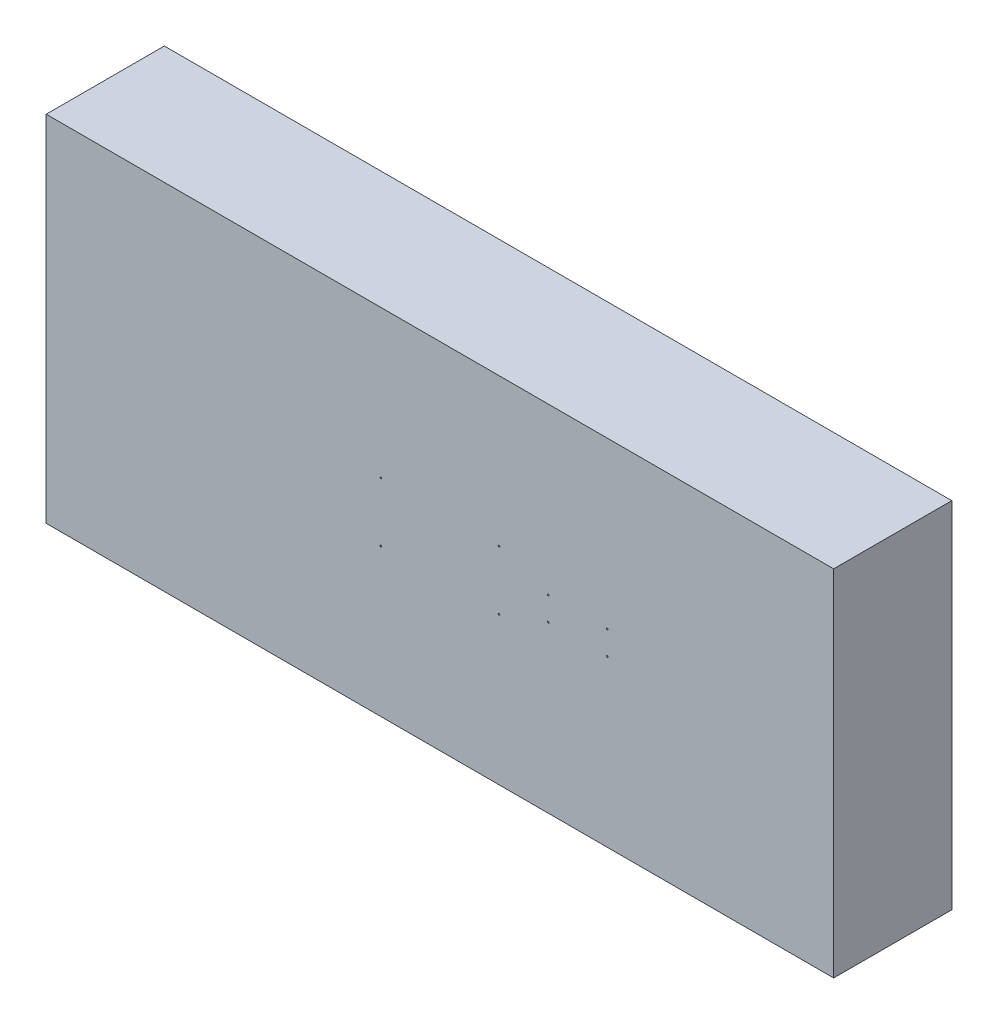
from build123d import *

# Parameters (mm, degrees)
BOSS_EXTRUDE2_DEPTH             = 500
BOSS_EXTRUDE2_DEPTH_BACK        = 500
SKETCH1_W                       = 450
SKETCH1_H                       = 150
F_2_0MM_DOWEL_HOLE1_D           = 2
F_2_0MM_DOWEL_HOLE1_DEPTH       = 10
F_2_0MM_DOWEL_HOLE1_CSINK_D     = 2.05
F_2_0MM_DOWEL_HOLE1_CSINK_ANGLE = 90
F_2_0MM_DOWEL_HOLE1_TIP         = 0.600860619
F_2_0MM_DOWEL_HOLE2_D           = 2
F_2_0MM_DOWEL_HOLE2_DEPTH       = 10
F_2_0MM_DOWEL_HOLE2_CSINK_D     = 2.05
F_2_0MM_DOWEL_HOLE2_CSINK_ANGLE = 90
F_2_0MM_DOWEL_HOLE2_TIP         = 0.600860619


with BuildPart() as part:
    # Sketch1 → Boss-Extrude2 (new, two sides: drawn at the far end of the back side and taken through both)
    with BuildSketch(Plane.YZ.offset(-BOSS_EXTRUDE2_DEPTH_BACK)):
        with Locations((-225, 75)):
            Rectangle(SKETCH1_W, SKETCH1_H)
    extrude(amount=BOSS_EXTRUDE2_DEPTH + BOSS_EXTRUDE2_DEPTH_BACK)

    # Ø2.0mm Dowel Hole1
    with Locations(Plane.XY.offset(150)):
        with Locations((75, -262.5), (-75, -187.5), (-75, -262.5), (75, -187.5)):
            CounterSinkHole(F_2_0MM_DOWEL_HOLE1_D / 2, F_2_0MM_DOWEL_HOLE1_CSINK_D / 2, depth=F_2_0MM_DOWEL_HOLE1_DEPTH, counter_sink_angle=F_2_0MM_DOWEL_HOLE1_CSINK_ANGLE)
            with Locations((0, 0, -(F_2_0MM_DOWEL_HOLE1_DEPTH + F_2_0MM_DOWEL_HOLE1_TIP / 2))):  # 118° drill point
                Cone(0, F_2_0MM_DOWEL_HOLE1_D / 2, F_2_0MM_DOWEL_HOLE1_TIP, mode=Mode.SUBTRACT)

    # Ø2.0mm Dowel Hole2
    with Locations(Plane.XY.offset(150)):
        with Locations((212.5, -210), (137.5, -210), (137.5, -240), (212.5, -240)):
            CounterSinkHole(F_2_0MM_DOWEL_HOLE2_D / 2, F_2_0MM_DOWEL_HOLE2_CSINK_D / 2, depth=F_2_0MM_DOWEL_HOLE2_DEPTH, counter_sink_angle=F_2_0MM_DOWEL_HOLE2_CSINK_ANGLE)
            with Locations((0, 0, -(F_2_0MM_DOWEL_HOLE2_DEPTH + F_2_0MM_DOWEL_HOLE2_TIP / 2))):  # 118° drill point
                Cone(0, F_2_0MM_DOWEL_HOLE2_D / 2, F_2_0MM_DOWEL_HOLE2_TIP, mode=Mode.SUBTRACT)


solid = part.part
